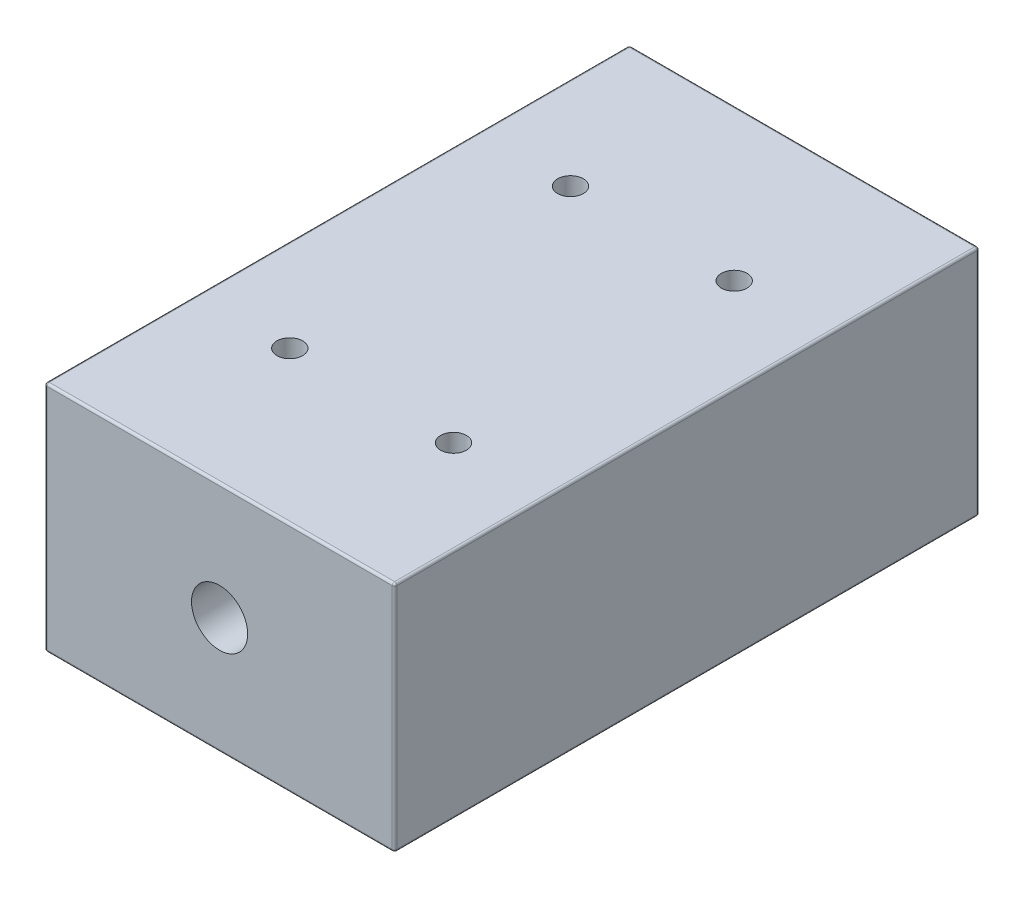
from build123d import *

# Parameters (mm, degrees)
SKETCH1_W                        = 74.8
SKETCH1_H                        = 49.8
SLIDER_BODY_DEPTH                = 125
SKETCH2_R                        = 11
LEAD_NUT_INSET_DEPTH             = 15
SKETCH3_R                        = 6
LEADSCREW_CLEARANCE_DEPTH        = 143.039008726
CORNER_BREAK_R                   = 0.5
BOLT_CLEARANCE_HOLES_D           = 5.5
SKETCH7_R                        = 6
NUT_CLEARANCE_COUNTERBORES_DEPTH = 10


with BuildPart() as part:
    # Sketch1 → slider body (new body)
    with BuildSketch(Plane.XY):
        with Locations((37.4, 24.9)):
            Rectangle(SKETCH1_W, SKETCH1_H)
    extrude(amount=SLIDER_BODY_DEPTH)

    # Sketch2 → lead nut inset (cut)
    with BuildSketch(Plane(origin=(0, 0, 0), x_dir=(-1, 0, 0), z_dir=(0, 0, -1))):
        with Locations((-37.4, 24.9)):
            Circle(SKETCH2_R)
    extrude(amount=-LEAD_NUT_INSET_DEPTH, mode=Mode.SUBTRACT)

    # Sketch3 → leadscrew clearance (cut, through all)
    with BuildSketch(Plane(origin=(0, 0, 15), x_dir=(-1, 0, 0), z_dir=(0, 0, -1))):
        with Locations((-37.4, 24.9)):
            Circle(SKETCH3_R)
    extrude(amount=-LEADSCREW_CLEARANCE_DEPTH, mode=Mode.SUBTRACT)

    # corner break
    corner_break_edges = [part.edges().sort_by_distance(p)[0] for p in [
        (74.8, 24.9, 125),
        (37.4, 49.8, 125),
        (0, 24.9, 125),
        (37.4, 49.8, 0),
        (74.8, 24.9, 0),
        (37.4, 0, 0),
        (0, 24.9, 0),
        (37.4, 0, 125),
        (0, 49.8, 62.5),
        (74.8, 49.8, 62.5),
        (74.8, 0, 62.5),
        (0, 0, 62.5),
    ]]
    fillet(corner_break_edges, radius=CORNER_BREAK_R)

    # bolt clearance holes (through all)
    with Locations(Plane(origin=(0, 49.8, 0), x_dir=(1, 0, 0), z_dir=(0, 1, 0))):
        with Locations((54.9, -92.5), (19.9, -32.5), (54.9, -32.5), (19.9, -92.5)):
            Hole(BOLT_CLEARANCE_HOLES_D / 2)

    # Sketch7 → nut clearance counterbores (cut)
    with BuildSketch(Plane.XZ):
        with Locations(Location((19.9, 92.5, 0), (0, 0, 270))):
            Circle(SKETCH7_R)
        with Locations(Location((54.9, 92.5, 0), (0, 0, 270))):
            Circle(SKETCH7_R)
        with Locations(Location((54.9, 32.5, 0), (0, 0, 270))):
            Circle(SKETCH7_R)
        with Locations(Location((19.9, 32.5, 0), (0, 0, 270))):
            Circle(SKETCH7_R)
    extrude(amount=-NUT_CLEARANCE_COUNTERBORES_DEPTH, mode=Mode.SUBTRACT)


solid = part.part
